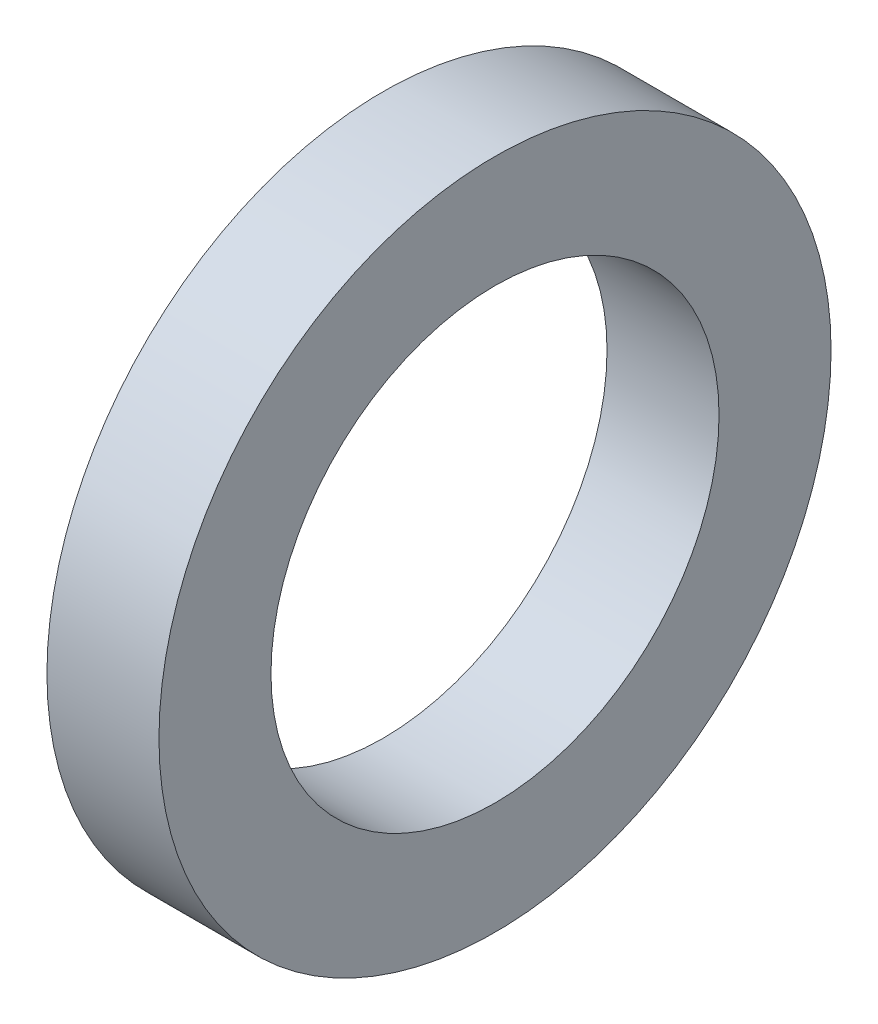
from build123d import *

# Parameters (mm, degrees)
SKETCH_2_W = 1
SKETCH_2_H = 1


with BuildPart() as part:
    # 草图2 → 旋转1 (revolve)
    with BuildSketch(Plane.XY, mode=Mode.PRIVATE) as revolve_1_sk:
        with Locations((0, 2.5)):
            Rectangle(SKETCH_2_W, SKETCH_2_H)
    revolve(revolve_1_sk.sketch.rotate(Axis((-0.5, 0, 0), (1, 0, 0)), 90), axis=Axis((-0.5, 0, 0), (1, 0, 0)))


solid = part.part
